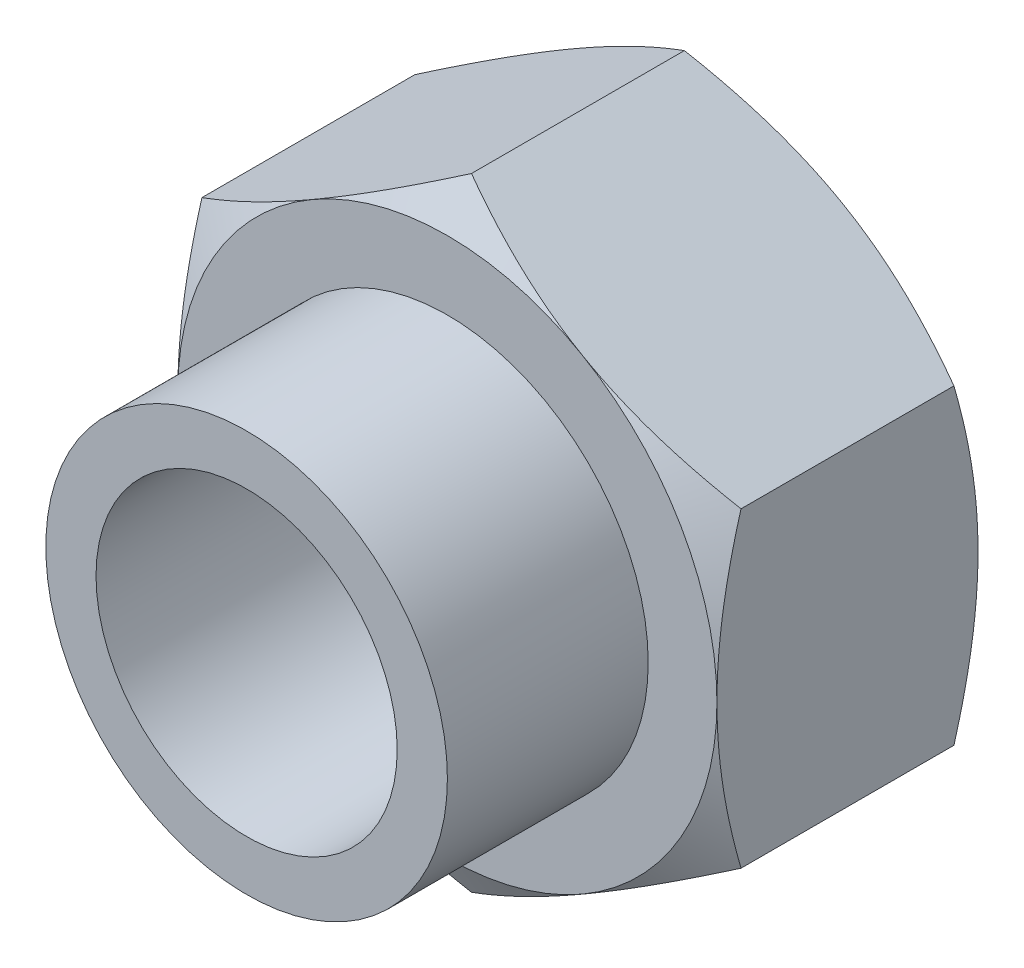
from build123d import *

# Parameters (mm, degrees)
SKETCH1_R           = 37.5
BOSS_EXTRUDE1_DEPTH = 32.5
SKETCH2_OUTSIDE_W   = 603.232
SKETCH2_OUTSIDE_H   = 623.998
SKETCH2_OUTSIDE_R   = 67.116968793
CUT_EXTRUDE1_DEPTH  = 122.391669813
CUT_EXTRUDE1_DRAFT  = -60
SKETCH3_OUTSIDE_W   = 603.232
SKETCH3_OUTSIDE_H   = 623.998
SKETCH3_OUTSIDE_R   = 67.116968793
CUT_EXTRUDE2_DEPTH  = 122.391669813
CUT_EXTRUDE2_DRAFT  = -60
SKETCH4_R           = 50
SKETCH4_R_2         = 37.5
BOSS_EXTRUDE2_DEPTH = 50


with BuildPart() as part:
    # Sketch1 → Boss-Extrude1 (new, symmetric)
    with BuildSketch(Plane.XY):
        Polygon((0, 77.5), (-67.116968793, 38.75), (-67.116968793, -38.75), (0, -77.5), (67.116968793, -38.75), (67.116968793, 38.75), align=None)
        Circle(SKETCH1_R, mode=Mode.SUBTRACT)
    extrude(amount=BOSS_EXTRUDE1_DEPTH, both=True)


with BuildPart() as cut_extrude1_tool:
    # Sketch2 outside → Cut-Extrude1 (with draft: the straight prism first)
    with BuildSketch(Plane.XY.offset(32.5)):
        Rectangle(SKETCH2_OUTSIDE_W, SKETCH2_OUTSIDE_H)
        Circle(SKETCH2_OUTSIDE_R, mode=Mode.SUBTRACT)
    extrude(amount=-CUT_EXTRUDE1_DEPTH)
    # Cut-Extrude1: the draft: its side faces are tilted about the plane it starts from
    cut_extrude1_sides = [cut_extrude1_tool.faces().sort_by_distance(p)[0] for p in [
        (0, -311.999, -28.695834907),
        (301.616, 0, -28.695834907),
        (0, 311.999, -28.695834907),
        (-301.616, 0, -28.695834907),
        (-67.116968793, 0, -28.695834907),
    ]]
    draft(cut_extrude1_sides, Plane.XY.offset(32.5), CUT_EXTRUDE1_DRAFT)


with BuildPart() as part_1:
    add(part.part)

    # Cut-Extrude1: cut by cut_extrude1_tool
    add(cut_extrude1_tool.part, mode=Mode.SUBTRACT)


with BuildPart() as cut_extrude2_tool:
    # Sketch3 outside → Cut-Extrude2 (with draft: the straight prism first)
    with BuildSketch(Plane(origin=(0, 0, -32.5), x_dir=(-1, 0, 0), z_dir=(0, 0, -1))):
        Rectangle(SKETCH3_OUTSIDE_W, SKETCH3_OUTSIDE_H)
        Circle(SKETCH3_OUTSIDE_R, mode=Mode.SUBTRACT)
    extrude(amount=-CUT_EXTRUDE2_DEPTH)
    # Cut-Extrude2: the draft: its side faces are tilted about the plane it starts from
    cut_extrude2_sides = [cut_extrude2_tool.faces().sort_by_distance(p)[0] for p in [
        (0, -311.999, 28.695834907),
        (-301.616, 0, 28.695834907),
        (0, 311.999, 28.695834907),
        (301.616, 0, 28.695834907),
        (67.116968793, 0, 28.695834907),
    ]]
    draft(cut_extrude2_sides, Plane(origin=(0, 0, -32.5), x_dir=(-1, 0, 0), z_dir=(0, 0, -1)), CUT_EXTRUDE2_DRAFT)


with BuildPart() as part_2:
    add(part_1.part)

    # Cut-Extrude2: cut by cut_extrude2_tool
    add(cut_extrude2_tool.part, mode=Mode.SUBTRACT)

    # Sketch4 → Boss-Extrude2 (add)
    with BuildSketch(Plane.XY.offset(32.5)):
        Circle(SKETCH4_R)
        Circle(SKETCH4_R_2, mode=Mode.SUBTRACT)
    extrude(amount=BOSS_EXTRUDE2_DEPTH)


solid = part_2.part
